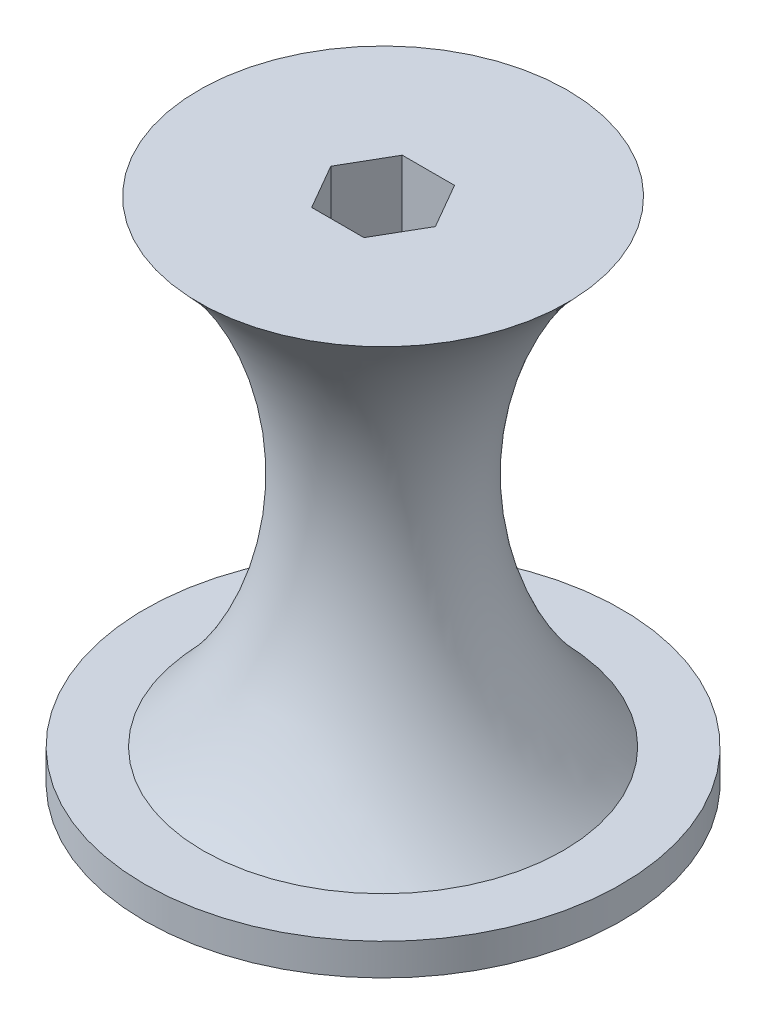
from build123d import *

# Parameters (mm, degrees)
SKETCH1_R           = 38.1
BOSS_EXTRUDE1_DEPTH = 5.08
CUT_EXTRUDE1_DEPTH  = 98.514006601


with BuildPart() as part:
    # Sketch1 → Boss-Extrude1 (new body)
    with BuildSketch(Plane(origin=(0, 0, 0), x_dir=(1, 0, 0), z_dir=(0, 1, 0))):
        with Locations(Location((0, 0, 0), (0, 0, 270))):
            Circle(SKETCH1_R)
    extrude(amount=-BOSS_EXTRUDE1_DEPTH)

    # Sketch4 → Revolve1 (revolve)
    with BuildSketch(Plane.XY, mode=Mode.PRIVATE) as revolve1_sk:
        with BuildLine():
            Line((0, 0), (0, 76.19583579))
            Line((0, 76.19583579), (29.449785718, 76.19583579))
            ThreePointArc((29.449785718, 76.19583579), (13.250608801, 38.235955518), (28.786938765, 0))
            Line((28.786938765, 0), (0, 0))
        make_face()
    revolve(revolve1_sk.sketch.rotate(Axis((0, 0, 0), (0, 1, 0)), 90), axis=Axis((0, 0, 0), (0, 1, 0)))

    # Sketch5 → Cut-Extrude1 (cut, through all)
    with BuildSketch(Plane(origin=(0, -5.08, 0), x_dir=(-1, 0, 0), z_dir=(0, -1, 0))):
        Polygon((8.358877197, 0), (4.179438599, 7.239), (-4.179438599, 7.239), (-8.358877197, 0), (-4.179438599, -7.239), (4.179438599, -7.239), align=None)
    extrude(amount=-CUT_EXTRUDE1_DEPTH, mode=Mode.SUBTRACT)


solid = part.part
